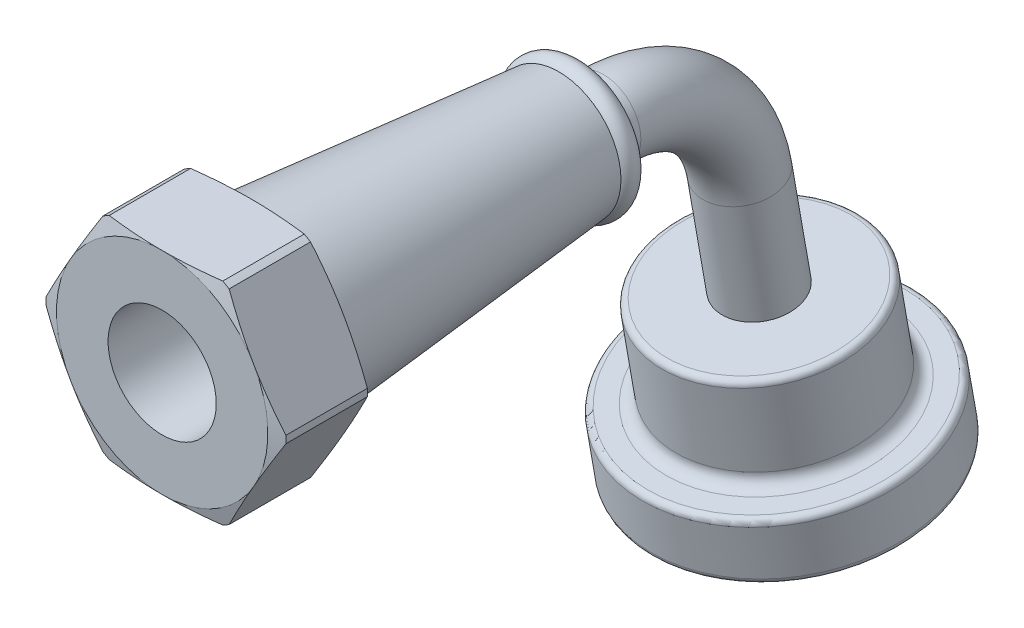
from build123d import *

# Parameters (mm, degrees)
SKETCH2_OUTSIDE_W  = 29.942
SKETCH2_OUTSIDE_H  = 29.942
CUT_EXTRUDE1_DEPTH = 10
SKETCH4_R          = 3
SKETCH4_R_2        = 1.8
FILLET1_R          = 0.5
FILLET2_R          = 1


with BuildPart() as part:
    # Sketch1 → Revolve1 (revolve)
    with BuildSketch(Plane(origin=(0, 0, 0), x_dir=(0, 0, -1), z_dir=(1, 0, 0)), mode=Mode.PRIVATE) as revolve1_sk:
        with BuildLine():
            Line((0, 4.35), (0, 8.5))
            Line((0, 8.5), (0.308141571, 9.65))
            Line((0.308141571, 9.65), (6.856921938, 9.65))
            Line((6.856921938, 9.65), (7.5, 7.25))
            Line((7.5, 7.25), (31.9, 5))
            ThreePointArc((31.9, 5), (32.7, 5.4), (33.5, 5))
            Line((33.5, 5), (33.5, 1.8))
            Line((33.5, 1.8), (13, 1.8))
            Line((13, 1.8), (13, 4.35))
            Line((13, 4.35), (0, 4.35))
        make_face()
    revolve(revolve1_sk.sketch.rotate(Axis((0, 0, 0), (0, 0, -1)), 90), axis=Axis((0, 0, 0), (0, 0, -1)))

    # Sketch2 outside → Cut-Extrude1 (cut)
    with BuildSketch(Plane.XY):
        Rectangle(SKETCH2_OUTSIDE_W, SKETCH2_OUTSIDE_H)
        Polygon((9.814954576, 0), (4.907477288, 8.5), (-4.907477288, 8.5), (-9.814954576, 0), (-4.907477288, -8.5), (4.907477288, -8.5), align=None, mode=Mode.SUBTRACT)
    extrude(amount=-CUT_EXTRUDE1_DEPTH, mode=Mode.SUBTRACT)

    # Sweep1: sweep along a path in Sketch3
    with BuildLine(Plane(origin=(0, 0, 0), x_dir=(0, 0, -1), z_dir=(1, 0, 0))) as sweep1_path:
        Line((33.5, 0), (35.5, 0))
        ThreePointArc((35.5, 0), (42.644218072, -2.600282725), (46.445577108, -9.184429715))
        Line((46.445577108, -9.184429715), (48, -18))
    # Sketch4 → Sweep1 (sweep)
    with BuildSketch(Plane(origin=(0, 0, -33.5), x_dir=(-1, 0, 0), z_dir=(0, 0, -1))):
        Circle(SKETCH4_R)
        Circle(SKETCH4_R_2, mode=Mode.SUBTRACT)
    sweep(path=sweep1_path.line)

    # Sketch5 → Revolve2 (revolve)
    with BuildSketch(Plane(origin=(0, 0, 0), x_dir=(0, 0, -1), z_dir=(1, 0, 0)), mode=Mode.PRIVATE) as revolve2_sk:
        Polygon((55.082984299, -29.951624719), (61.090311593, -28.892370835), (60.222070704, -23.96833207), (57.267647445, -24.489276603), (55.878462024, -16.610814579), (49.772653955, -17.68743328), (50.988191199, -24.581087551), (54.041095233, -24.042778201), align=None)
    revolve(revolve2_sk.sketch.rotate(Axis((0, -18, -48), (0, -0.9848077530122075, -0.1736481776669341)), 180), axis=Axis((0, -18, -48), (0, -0.9848077530122075, -0.1736481776669341)))

    # Fillet1
    fillet1_edges = [part.edges().sort_by_distance(p)[0] for p in [
        (0, -28.892370835, -61.090311593),
        (0, -23.96833207, -60.222070704),
        (0, -16.610814579, -55.878462024),
    ]]
    fillet(fillet1_edges, radius=FILLET1_R)

    # Fillet2
    fillet2_edges = [part.edges().sort_by_distance(p)[0] for p in [
        (0, -24.489276603, -57.267647445),
    ]]
    fillet(fillet2_edges, radius=FILLET2_R)


solid = part.part
